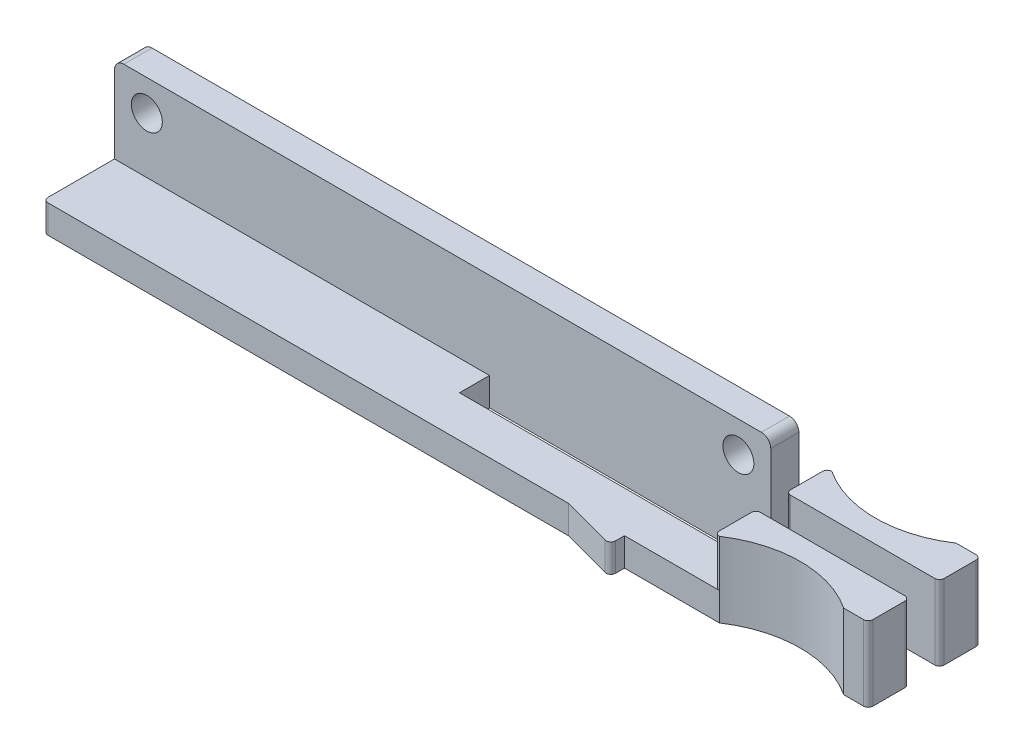
from build123d import *

# Parameters (mm, degrees)
EXTRUDE_1_DEPTH     = 3
SKETCH_4_W          = 70
SKETCH_4_H          = 3
EXTRUDE_2_DEPTH     = 9.25
CUT_EXTRUDE_1_REACH = 91.308
SKETCH_5_R          = 1.65
FILLET_1_R          = 1
EXTRUDE_3_DEPTH     = 5


with BuildPart() as part:
    # ｽｹｯﾁ2 → ﾎﾞｽ - 押し出し1 (new body)
    with BuildSketch(Plane(origin=(0, 0, 0), x_dir=(1, 0, 0), z_dir=(0, 1, 0))):
        with BuildLine():
            Line((70, 7.6), (40, 7.6))
            Line((40, 7.6), (40, 4.4))
            Line((40, 4.4), (70, 4.4))
            Line((70, 4.4), (87.5, 4.4))
            ThreePointArc((87.5, 4.4), (87.853553391, 4.253553391), (88, 3.9))
            Line((88, 3.9), (88, 0.5))
            ThreePointArc((88, 0.5), (87.853553391, 0.146446609), (87.5, 0))
            Line((87.5, 0), (85.383249581, 0))
            ThreePointArc((85.383249581, 0), (78.75, 2), (72.116750419, 0))
            Line((72.116750419, 0), (70, 0))
            Line((70, 0), (62, 0))
            Line((62, 0), (62, -0.949194177))
            ThreePointArc((62, -0.949194177), (61.80461807, -1.345688605), (61.371168675, -1.432311647))
            Line((61.371168675, -1.432311647), (56, 0))
            Line((56, 0), (0.5, 0))
            ThreePointArc((0.5, 0), (0.146446609, 0.146446609), (0, 0.5))
            Line((0, 0.5), (0, 11.5))
            ThreePointArc((0, 11.5), (0.146446609, 11.853553391), (0.5, 12))
            Line((0.5, 12), (70, 12))
            Line((70, 12), (72.116750419, 12))
            ThreePointArc((72.116750419, 12), (78.75, 10), (85.383249581, 12))
            Line((85.383249581, 12), (87.5, 12))
            ThreePointArc((87.5, 12), (87.853553391, 11.853553391), (88, 11.5))
            Line((88, 11.5), (88, 8.1))
            ThreePointArc((88, 8.1), (87.853553391, 7.746446609), (87.5, 7.6))
            Line((87.5, 7.6), (70, 7.6))
        make_face()
    extrude(amount=EXTRUDE_1_DEPTH)

    # ｽｹｯﾁ4 → ﾎﾞｽ - 押し出し2 (add)
    with BuildSketch(Plane(origin=(0, 3, 0), x_dir=(1, 0, 0), z_dir=(0, 1, 0))):
        with Locations((35, 9.1)):
            Rectangle(SKETCH_4_W, SKETCH_4_H)
    extrude(amount=EXTRUDE_2_DEPTH)

    # ｽｹｯﾁ5 → ｶｯﾄ - 押し出し1 (cut, up to next)
    with BuildSketch(Plane.XY.offset(-7.6), mode=Mode.PRIVATE) as cut_extrude_1_sk1:
        with Locations((3.45, 8.95)):
            Circle(SKETCH_5_R)
    cut_extrude_1_tool1 = extrude(cut_extrude_1_sk1.sketch, amount=-CUT_EXTRUDE_1_REACH, mode=Mode.PRIVATE) & part.part
    # ｽｹｯﾁ5 → ｶｯﾄ - 押し出し1 (cut, up to next)
    with BuildSketch(Plane.XY.offset(-7.6), mode=Mode.PRIVATE) as cut_extrude_1_sk2:
        with Locations((66.55, 8.95)):
            Circle(SKETCH_5_R)
    cut_extrude_1_tool2 = extrude(cut_extrude_1_sk2.sketch, amount=-CUT_EXTRUDE_1_REACH, mode=Mode.PRIVATE) & part.part
    add(cut_extrude_1_tool1.solids().sort_by_distance((3.45, 8.95, -7.6))[0], mode=Mode.SUBTRACT)
    add(cut_extrude_1_tool2.solids().sort_by_distance((66.55, 8.95, -7.6))[0], mode=Mode.SUBTRACT)

    # ﾌｨﾚｯﾄ1
    fillet_1_edges = [part.edges().sort_by_distance(p)[0] for p in [
        (70, 12.25, -9.1),
        (0, 12.25, -9.1),
    ]]
    fillet(fillet_1_edges, radius=FILLET_1_R)

    # ｽｹｯﾁ6 → ﾎﾞｽ - 押し出し3 (add)
    with BuildSketch(Plane(origin=(0, 3, 0), x_dir=(1, 0, 0), z_dir=(0, 1, 0))):
        with BuildLine():
            Line((88, 11.5), (88, 8.1))
            ThreePointArc((88, 8.1), (87.853553391, 7.746446609), (87.5, 7.6))
            Line((87.5, 7.6), (72.116750419, 7.6))
            ThreePointArc((72.116750419, 7.6), (71.763197029, 7.746446609), (71.616750419, 8.1))
            Line((71.616750419, 8.1), (71.616750419, 11.5))
            ThreePointArc((71.616750419, 11.5), (71.763197029, 11.853553391), (72.116750419, 12))
            ThreePointArc((72.116750419, 12), (78.75, 10), (85.383249581, 12))
            Line((85.383249581, 12), (87.5, 12))
            ThreePointArc((87.5, 12), (87.853553391, 11.853553391), (88, 11.5))
        make_face()
        with BuildLine():
            Line((88, 3.9), (88, 0.5))
            ThreePointArc((88, 0.5), (87.853553391, 0.146446609), (87.5, 0))
            Line((87.5, 0), (85.383249581, 0))
            ThreePointArc((85.383249581, 0), (78.75, 2), (72.116750419, 0))
            ThreePointArc((72.116750419, 0), (71.763197029, 0.146446609), (71.616750419, 0.5))
            Line((71.616750419, 0.5), (71.616750419, 3.9))
            ThreePointArc((71.616750419, 3.9), (71.763197029, 4.253553391), (72.116750419, 4.4))
            Line((72.116750419, 4.4), (87.5, 4.4))
            ThreePointArc((87.5, 4.4), (87.853553391, 4.253553391), (88, 3.9))
        make_face()
    extrude(amount=EXTRUDE_3_DEPTH)


solid = part.part
